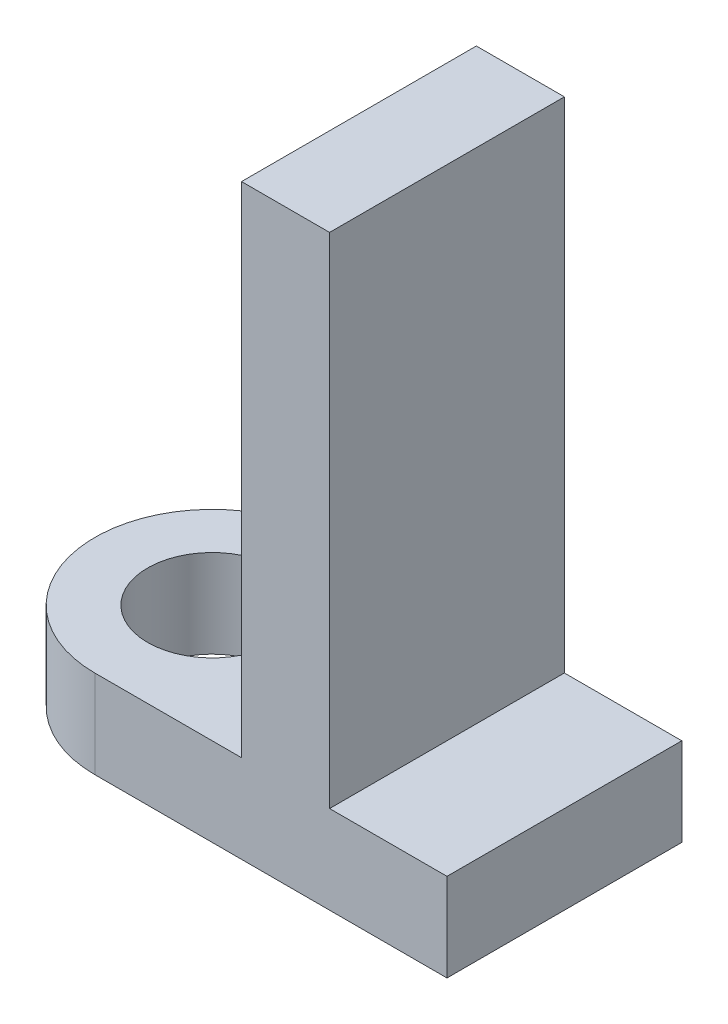
from build123d import *

# Parameters (mm, degrees)
IZIM1_R                     = 110
Y_KSEKLIK_EKSTR_ZYON1_DEPTH = 150
Y_KSEKLIK_EKSTR_ZYON2_DEPTH = 850


with BuildPart() as part:
    # Çizim1 → Yükseklik-Ekstrüzyon1 (new body)
    with BuildSketch(Plane(origin=(0, 0, 0), x_dir=(1, 0, 0), z_dir=(0, 1, 0))):
        with BuildLine():
            Line((-45.031937832, 227.98151627), (554.968062168, 227.98151627))
            Line((554.968062168, 227.98151627), (554.968062168, -172.01848373))
            Line((554.968062168, -172.01848373), (-45.031937832, -172.01848373))
            ThreePointArc((-45.031937832, -172.01848373), (-245.031937832, 27.98151627), (-45.031937832, 227.98151627))
        make_face()
        with Locations(Location((-45.031937832, 27.98151627, 0), (0, 0, 270))):
            Circle(IZIM1_R, mode=Mode.SUBTRACT)
    extrude(amount=Y_KSEKLIK_EKSTR_ZYON1_DEPTH)

    # Çizim4 → Yükseklik-Ekstrüzyon2 (add)
    with BuildSketch(Plane(origin=(0, 150, 0), x_dir=(1, 0, 0), z_dir=(0, 1, 0))):
        Polygon((354.968062168, 27.98151627), (354.968062168, 227.98151627), (204.968062168, 227.98151627), (204.968062168, -172.01848373), (354.968062168, -172.01848373), align=None)
    extrude(amount=Y_KSEKLIK_EKSTR_ZYON2_DEPTH)


solid = part.part
